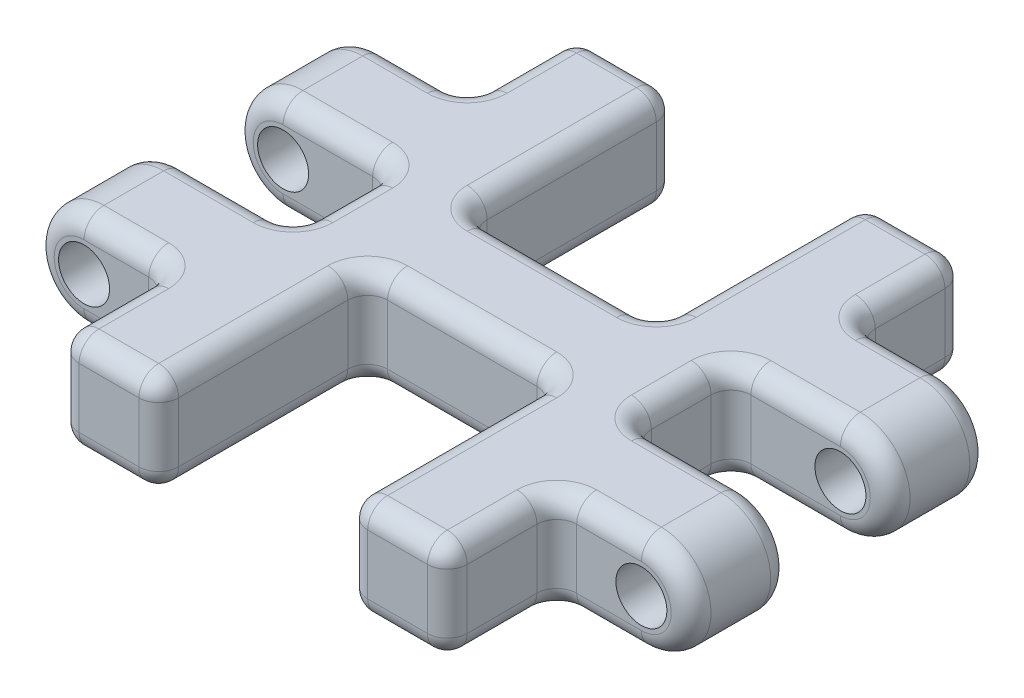
from build123d import *

# Parameters (mm, degrees)
BOSS_EXTRUDE1_DEPTH = 16.51
SKETCH2_W           = 12.065
SKETCH2_H           = 13.335
SKETCH2_W_2         = 8.5725
SKETCH2_H_2         = 6.985
SKETCH2_W_3         = 10.16
SKETCH2_H_3         = 6.35
CUT_EXTRUDE1_DEPTH  = 6.35
CUT_EXTRUDE2_REACH  = 35.571
SKETCH3_R           = 1.627
FILLET1_R           = 1.27


with BuildPart() as part:
    # Sketch1 → Boss-Extrude1 (new, symmetric)
    with BuildSketch(Plane.XY):
        with BuildLine():
            Line((17.78, -3.175), (-17.78, -3.175))
            ThreePointArc((-17.78, -3.175), (-20.955, 0), (-17.78, 3.175))
            Line((-17.78, 3.175), (17.78, 3.175))
            ThreePointArc((17.78, 3.175), (20.955, 0), (17.78, -3.175))
        make_face()
    extrude(amount=BOSS_EXTRUDE1_DEPTH, both=True)

    # Sketch2 → Cut-Extrude1 (cut)
    with BuildSketch(Plane(origin=(0, 3.175, 0), x_dir=(1, 0, 0), z_dir=(0, 1, 0))):
        with Locations((0, 9.8425)):
            Rectangle(SKETCH2_W, SKETCH2_H)
        with Locations((-16.66875, 13.0175)):
            Rectangle(SKETCH2_W_2, SKETCH2_H_2)
        with Locations((16.66875, 13.0175)):
            Rectangle(SKETCH2_W_2, SKETCH2_H_2)
        with Locations((-15.875, 0)):
            Rectangle(SKETCH2_W_3, SKETCH2_H_3)
        with Locations((15.875, 0)):
            Rectangle(SKETCH2_W_3, SKETCH2_H_3)
    cut_extrude1 = extrude(amount=-CUT_EXTRUDE1_DEPTH, mode=Mode.SUBTRACT)

    # Mirror1: Cut-Extrude1 across plane
    add(cut_extrude1.mirror(Plane.XY), mode=Mode.SUBTRACT)

    # Cut-Extrude2: up to this face of the body (flat: up to its plane)
    cut_extrude2_end = Plane(part.part.faces().sort_by_distance((-16.359888841, 0, -9.525))[0])
    # Sketch3 → Cut-Extrude2 (cut, up to the picked face)
    with BuildSketch(Plane.XY.offset(9.525), mode=Mode.PRIVATE) as cut_extrude2_sk1:
        with Locations((-17.78, 0)):
            Circle(SKETCH3_R)
    cut_extrude2_tool1 = split(extrude(cut_extrude2_sk1.sketch, amount=-CUT_EXTRUDE2_REACH, mode=Mode.PRIVATE), bisect_by=cut_extrude2_end, keep=Keep.BOTH, mode=Mode.PRIVATE)
    cut_extrude2 = cut_extrude2_tool1.solids().sort_by(Axis((-17.78, 0, 9.525), (0, 0, -1)))[0]
    add(cut_extrude2, mode=Mode.SUBTRACT)

    # Mirror2: Cut-Extrude2 across plane
    add(cut_extrude2.mirror(Plane(origin=(0, 0, 0), x_dir=(0, 0, 1), z_dir=(1, 0, 0))), mode=Mode.SUBTRACT)

    # Fillet1
    fillet1_edges = [part.edges().sort_by_distance(p)[0] for p in [
        (9.2075, 3.175, 16.51),
        (-9.2075, 3.175, 16.51),
        (-9.2075, -3.175, 16.51),
        (9.2075, -3.175, 16.51),
        (-9.2075, -3.175, -16.51),
        (9.2075, -3.175, -16.51),
        (15.08125, -3.175, 9.525),
        (12.3825, 0, 9.525),
        (15.08125, 3.175, 9.525),
        (20.955, 0, 9.525),
        (12.3825, -3.175, 13.0175),
        (12.3825, 0, 16.51),
        (12.3825, 3.175, 13.0175),
        (9.2075, 3.175, -16.51),
        (-15.08125, 3.175, 9.525),
        (-15.08125, -3.175, 9.525),
        (-20.955, 0, 9.525),
        (-12.3825, 0, 16.51),
        (-12.3825, -3.175, 13.0175),
        (-12.3825, 0, 9.525),
        (-12.3825, 3.175, 13.0175),
        (-9.2075, 3.175, -16.51),
        (6.0325, 0, 16.51),
        (6.0325, -3.175, 9.8425),
        (6.0325, 0, 3.175),
        (6.0325, 3.175, 9.8425),
        (0, -3.175, 3.175),
        (-6.0325, 0, 3.175),
        (0, 3.175, 3.175),
        (-6.0325, -3.175, 9.8425),
        (-6.0325, 0, 16.51),
        (-6.0325, 3.175, 9.8425),
        (-14.2875, -3.175, -3.175),
        (14.2875, -3.175, 3.175),
        (10.795, -3.175, 0),
        (14.2875, -3.175, -3.175),
        (20.955, 0, -3.175),
        (10.795, 0, -3.175),
        (20.955, 0, 3.175),
        (10.795, 0, 3.175),
        (14.2875, 3.175, 3.175),
        (14.2875, 3.175, -3.175),
        (10.795, 3.175, 0),
        (-20.955, 0, -3.175),
        (-20.955, 0, 3.175),
        (-10.795, 0, 3.175),
        (-10.795, 0, -3.175),
        (-14.2875, 3.175, 3.175),
        (-10.795, 3.175, 0),
        (-14.2875, 3.175, -3.175),
        (-14.2875, -3.175, 3.175),
        (-10.795, -3.175, 0),
        (12.3825, 0, -16.51),
        (20.955, 0, -9.525),
        (15.08125, -3.175, -9.525),
        (12.3825, -3.175, -13.0175),
        (12.3825, 0, -9.525),
        (15.08125, 3.175, -9.525),
        (12.3825, 3.175, -13.0175),
        (-20.955, 0, -9.525),
        (-12.3825, 0, -9.525),
        (-15.08125, 3.175, -9.525),
        (-12.3825, 3.175, -13.0175),
        (-12.3825, 0, -16.51),
        (-15.08125, -3.175, -9.525),
        (-12.3825, -3.175, -13.0175),
        (-6.0325, 0, -3.175),
        (-6.0325, 0, -16.51),
        (6.0325, 0, -16.51),
        (6.0325, 0, -3.175),
        (-6.0325, 3.175, -9.8425),
        (0, 3.175, -3.175),
        (6.0325, 3.175, -9.8425),
        (-6.0325, -3.175, -9.8425),
        (6.0325, -3.175, -9.8425),
        (0, -3.175, -3.175),
    ]]
    fillet(fillet1_edges, radius=FILLET1_R)


solid = part.part
